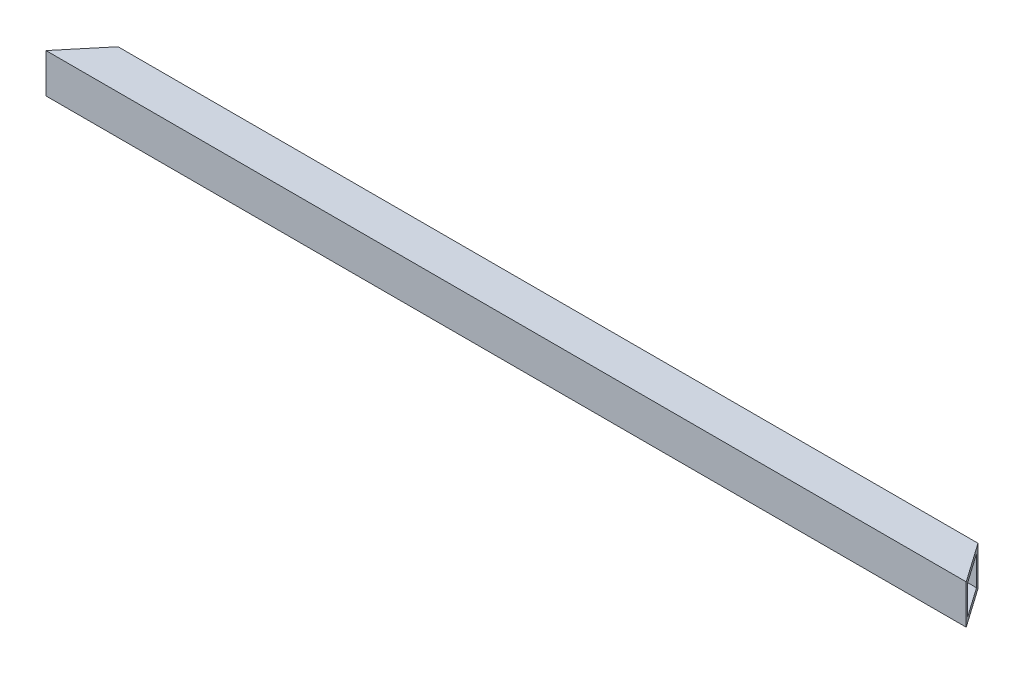
from build123d import *

# Parameters (mm, degrees)
SKETCH1_W               = 12.7
SKETCH1_H               = 12.7
SKETCH1_W_2             = 9.525
SKETCH1_H_2             = 9.525
BOSS_EXTRUDE1_DEPTH     = 148.59
CUT_EXTRUDE1_DEPTH      = 149.861120176
CUT_EXTRUDE1_DEPTH_BACK = 149.861120176
CUT_EXTRUDE2_DEPTH      = 149.861120176
CUT_EXTRUDE2_DEPTH_BACK = 149.861120176


with BuildPart() as part:
    # Sketch1 → Boss-Extrude1 (new, symmetric)
    with BuildSketch(Plane(origin=(0, 0, 0), x_dir=(0, 0, -1), z_dir=(1, 0, 0))):
        Rectangle(SKETCH1_W, SKETCH1_H)
        Rectangle(SKETCH1_W_2, SKETCH1_H_2, mode=Mode.SUBTRACT)
    extrude(amount=BOSS_EXTRUDE1_DEPTH, both=True)

    # Sketch2 → Cut-Extrude1 (cut, two sides: drawn at the far end of the back side and taken through both)
    with BuildSketch(Plane(origin=(0, 0, 0), x_dir=(1, 0, 0), z_dir=(0, 1, 0)).offset(-CUT_EXTRUDE1_DEPTH_BACK)):
        Polygon((148.59, -6.35), (125.346319759, 26.845415605), (148.59, 26.845415605), align=None)
    extrude(amount=CUT_EXTRUDE1_DEPTH + CUT_EXTRUDE1_DEPTH_BACK, mode=Mode.SUBTRACT)

    # Sketch3 → Cut-Extrude2 (cut, two sides: drawn at the far end of the back side and taken through both)
    with BuildSketch(Plane(origin=(0, 0, 0), x_dir=(1, 0, 0), z_dir=(0, 1, 0)).offset(-CUT_EXTRUDE2_DEPTH_BACK)):
        Polygon((-138.016734859, 6.35), (-148.59, -6.35), (-148.59, 6.35), align=None)
    extrude(amount=CUT_EXTRUDE2_DEPTH + CUT_EXTRUDE2_DEPTH_BACK, mode=Mode.SUBTRACT)


solid = part.part
